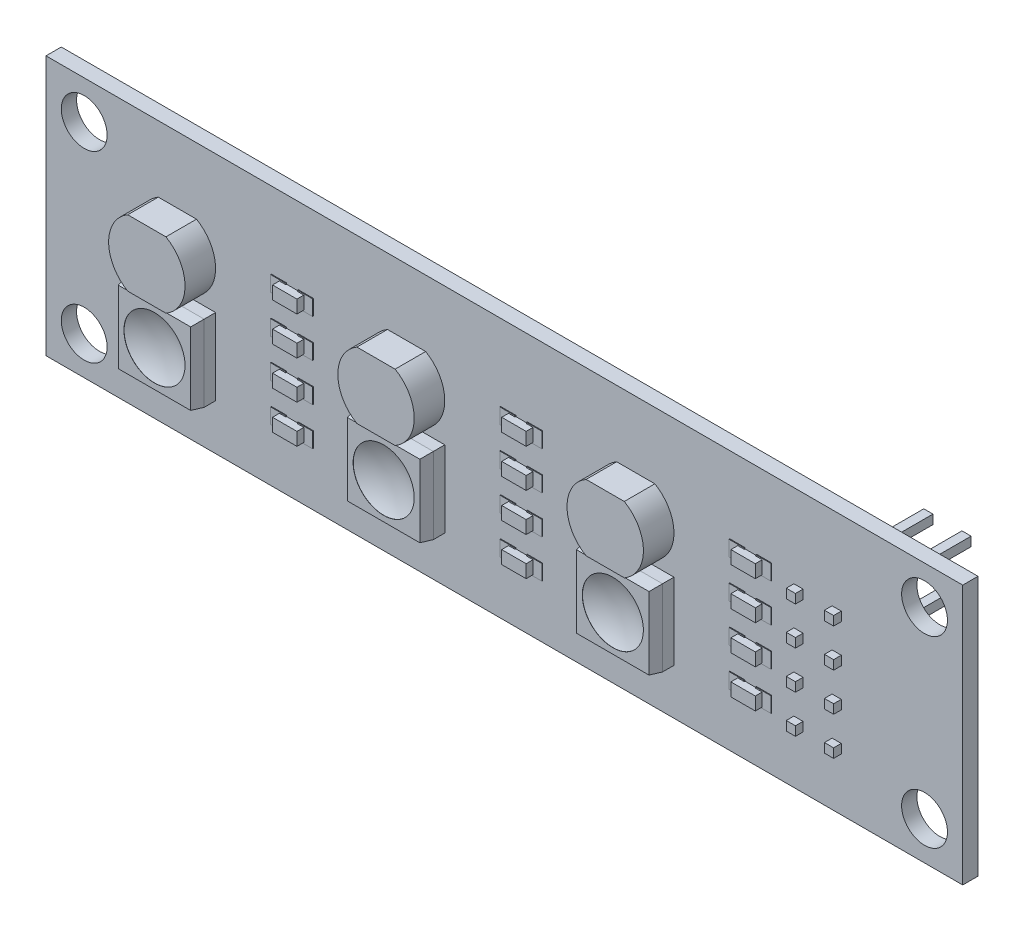
from build123d import *

# Parameters (mm, degrees)
CROQUIS1_W                  = 60
CROQUIS1_H                  = 17
CROQUIS1_R                  = 1.5
SALIENTE_EXTRUIR1_DEPTH     = 1
CROQUIS2_W                  = 5
CROQUIS2_H                  = 5
SALIENTE_EXTRUIR2_DEPTH     = 0.75
CROQUIS3_W                  = 5
CROQUIS3_H                  = 5
SALIENTE_EXTRUIR3_DEPTH     = 0.75
SALIENTE_EXTRUIR3_TAPER     = 10
CROQUIS4_R                  = 2
CORTAR_EXTRUIR1_DEPTH       = 0.01
C_PULA1_FACE_RADIUS         = 2
C_PULA1_HEIGHT              = 0.5
MATRIZL6_COUNT              = 3
MATRIZL6_PITCH              = 15
MATRIZL6_COPY_1_FACE_RADIUS = 2
MATRIZL6_COPY_1_HEIGHT      = 0.5
MATRIZL6_COPY_2_FACE_RADIUS = 2
MATRIZL6_COPY_2_HEIGHT      = 0.5
SALIENTE_EXTRUIR4_DEPTH     = 2
MATRIZL7_COUNT              = 3
MATRIZL7_PITCH              = 15
CROQUIS6_W                  = 1
CROQUIS6_H                  = 1
SALIENTE_EXTRUIR5_DEPTH     = 0.05
CROQUIS7_W                  = 1.6
CROQUIS7_H                  = 0.85
SALIENTE_EXTRUIR6_DEPTH     = 0.5
MATRIZL8_COUNT              = 3
MATRIZL8_PITCH              = 15
MATRIZL8_COUNT_DIR2         = 4
MATRIZL8_PITCH_DIR2         = 2.5
SALIENTE_EXTRUIR7_DEPTH     = 2.5
CROQUIS9_W                  = 0.6
CROQUIS9_H                  = 0.6
SALIENTE_EXTRUIR8_DEPTH     = 6
MATRIZL9_COUNT              = 4
MATRIZL9_PITCH              = 2.5
CROQUIS10_W                 = 0.6
CROQUIS10_H                 = 0.6
SALIENTE_EXTRUIR9_DEPTH     = 9
MATRIZL10_COUNT             = 4
MATRIZL10_PITCH             = 2.5
MATRIZL10_COUNT_DIR2        = 2
MATRIZL10_PITCH_DIR2        = 2.5


with BuildPart() as part:
    # Croquis1 → Saliente-Extruir1 (new body)
    with BuildSketch(Plane.XY):
        Rectangle(CROQUIS1_W, CROQUIS1_H)
        with Locations((-27.5, 6)):
            Circle(CROQUIS1_R, mode=Mode.SUBTRACT)
        with Locations(Location((-27.5, -6, 0), (0, 0, 180))):
            Circle(CROQUIS1_R, mode=Mode.SUBTRACT)
        with Locations((27.5, -6)):
            Circle(CROQUIS1_R, mode=Mode.SUBTRACT)
        with Locations(Location((27.5, 6, 0), (0, 0, 180))):
            Circle(CROQUIS1_R, mode=Mode.SUBTRACT)
    extrude(amount=SALIENTE_EXTRUIR1_DEPTH)

    # Croquis2 → Saliente-Extruir2 (add)
    with BuildSketch(Plane.XY.offset(1)):
        with Locations((-21.4, -3)):
            Rectangle(CROQUIS2_W, CROQUIS2_H)
    saliente_extruir2 = extrude(amount=SALIENTE_EXTRUIR2_DEPTH)

    # Croquis3 → Saliente-Extruir3 (add)
    with BuildSketch(Plane.XY.offset(1.75)):
        with Locations((-21.4, -3)):
            Rectangle(CROQUIS3_W, CROQUIS3_H)
    saliente_extruir3 = extrude(amount=SALIENTE_EXTRUIR3_DEPTH, taper=SALIENTE_EXTRUIR3_TAPER)

    # Croquis4 → Cortar-Extruir1 (cut)
    with BuildSketch(Plane.XY.offset(2.5)):
        with Locations((-21.4, -3)):
            Circle(CROQUIS4_R)
    cortar_extruir1 = extrude(amount=-CORTAR_EXTRUIR1_DEPTH, mode=Mode.SUBTRACT)

    # Cúpula1: a dome of height H over a round flat face of radius A is a cap of a sphere of radius (A * A + H * H) / (2 * H)
    c_pula1_r = (C_PULA1_FACE_RADIUS * C_PULA1_FACE_RADIUS + C_PULA1_HEIGHT * C_PULA1_HEIGHT) / (2 * C_PULA1_HEIGHT)
    c_pula1_base = Plane((-21.4, -3, 2.49), z_dir=(0, 0, -1))
    with Locations(c_pula1_base.offset(C_PULA1_HEIGHT - c_pula1_r)):
        c_pula1_ball = Sphere(c_pula1_r, mode=Mode.PRIVATE)
    add(split(c_pula1_ball, bisect_by=c_pula1_base, keep=Keep.TOP, mode=Mode.PRIVATE), mode=Mode.SUBTRACT)

    # MatrizL6: Saliente-Extruir2, Saliente-Extruir3, Cortar-Extruir1 ×3
    with Locations(*[(i * MATRIZL6_PITCH, 0, 0) for i in range(1, MATRIZL6_COUNT)]):
        add(saliente_extruir2)
        add(saliente_extruir3)
        add(cortar_extruir1, mode=Mode.SUBTRACT)

    # MatrizL6 copy 1: a dome of height H over a round flat face of radius A is a cap of a sphere of radius (A * A + H * H) / (2 * H)
    matrizl6_copy_1_r = (MATRIZL6_COPY_1_FACE_RADIUS * MATRIZL6_COPY_1_FACE_RADIUS + MATRIZL6_COPY_1_HEIGHT * MATRIZL6_COPY_1_HEIGHT) / (2 * MATRIZL6_COPY_1_HEIGHT)
    matrizl6_copy_1_base = Plane((-6.4, -3, 2.49), z_dir=(0, 0, -1))
    with Locations(matrizl6_copy_1_base.offset(MATRIZL6_COPY_1_HEIGHT - matrizl6_copy_1_r)):
        matrizl6_copy_1_ball = Sphere(matrizl6_copy_1_r, mode=Mode.PRIVATE)
    add(split(matrizl6_copy_1_ball, bisect_by=matrizl6_copy_1_base, keep=Keep.TOP, mode=Mode.PRIVATE), mode=Mode.SUBTRACT)

    # MatrizL6 copy 2: a dome of height H over a round flat face of radius A is a cap of a sphere of radius (A * A + H * H) / (2 * H)
    matrizl6_copy_2_r = (MATRIZL6_COPY_2_FACE_RADIUS * MATRIZL6_COPY_2_FACE_RADIUS + MATRIZL6_COPY_2_HEIGHT * MATRIZL6_COPY_2_HEIGHT) / (2 * MATRIZL6_COPY_2_HEIGHT)
    matrizl6_copy_2_base = Plane((8.6, -3, 2.49), z_dir=(0, 0, -1))
    with Locations(matrizl6_copy_2_base.offset(MATRIZL6_COPY_2_HEIGHT - matrizl6_copy_2_r)):
        matrizl6_copy_2_ball = Sphere(matrizl6_copy_2_r, mode=Mode.PRIVATE)
    add(split(matrizl6_copy_2_ball, bisect_by=matrizl6_copy_2_base, keep=Keep.TOP, mode=Mode.PRIVATE), mode=Mode.SUBTRACT)

    # Croquis5 → Saliente-Extruir4 (add)
    with BuildSketch(Plane.XY.offset(1)):
        with BuildLine():
            Line((-22.65, 4.165063509), (-20.15, 4.165063509))
            ThreePointArc((-20.15, 4.165063509), (-18.9, 2), (-20.15, -0.165063509))
            Line((-20.15, -0.165063509), (-22.65, -0.165063509))
            ThreePointArc((-22.65, -0.165063509), (-23.9, 2), (-22.65, 4.165063509))
        make_face()
    saliente_extruir4 = extrude(amount=SALIENTE_EXTRUIR4_DEPTH)

    # MatrizL7: Saliente-Extruir4 ×3
    with Locations(*[(i * MATRIZL7_PITCH, 0, 0) for i in range(1, MATRIZL7_COUNT)]):
        add(saliente_extruir4)

    # Croquis6 → Saliente-Extruir5 (add)
    with BuildSketch(Plane.XY.offset(1)):
        with Locations((-14.75, -4.5)):
            Rectangle(CROQUIS6_W, CROQUIS6_H)
        with Locations((-13, -4.5)):
            Rectangle(CROQUIS6_W, CROQUIS6_H)
        with Locations((0.25, -4.5)):
            Rectangle(CROQUIS6_W, CROQUIS6_H)
        with Locations((2, -4.5)):
            Rectangle(CROQUIS6_W, CROQUIS6_H)
        with Locations((15.25, -4.5)):
            Rectangle(CROQUIS6_W, CROQUIS6_H)
        with Locations((17, -4.5)):
            Rectangle(CROQUIS6_W, CROQUIS6_H)
        with Locations((0.25, -2)):
            Rectangle(CROQUIS6_W, CROQUIS6_H)
        with Locations((2, -2)):
            Rectangle(CROQUIS6_W, CROQUIS6_H)
        with Locations((15.25, -2)):
            Rectangle(CROQUIS6_W, CROQUIS6_H)
        with Locations((17, -2)):
            Rectangle(CROQUIS6_W, CROQUIS6_H)
        with Locations((0.25, 0.5)):
            Rectangle(CROQUIS6_W, CROQUIS6_H)
        with Locations((2, 0.5)):
            Rectangle(CROQUIS6_W, CROQUIS6_H)
        with Locations((15.25, 0.5)):
            Rectangle(CROQUIS6_W, CROQUIS6_H)
        with Locations((17, 0.5)):
            Rectangle(CROQUIS6_W, CROQUIS6_H)
        with Locations((0.25, 3)):
            Rectangle(CROQUIS6_W, CROQUIS6_H)
        with Locations((2, 3)):
            Rectangle(CROQUIS6_W, CROQUIS6_H)
        with Locations((15.25, 3)):
            Rectangle(CROQUIS6_W, CROQUIS6_H)
        with Locations((17, 3)):
            Rectangle(CROQUIS6_W, CROQUIS6_H)
        with Locations((-14.75, -2)):
            Rectangle(CROQUIS6_W, CROQUIS6_H)
        with Locations((-13, -2)):
            Rectangle(CROQUIS6_W, CROQUIS6_H)
        with Locations((-14.75, 0.5)):
            Rectangle(CROQUIS6_W, CROQUIS6_H)
        with Locations((-13, 0.5)):
            Rectangle(CROQUIS6_W, CROQUIS6_H)
        with Locations((-14.75, 3)):
            Rectangle(CROQUIS6_W, CROQUIS6_H)
        with Locations((-13, 3)):
            Rectangle(CROQUIS6_W, CROQUIS6_H)
    extrude(amount=SALIENTE_EXTRUIR5_DEPTH)

    # Croquis7 → Saliente-Extruir6 (add)
    with BuildSketch(Plane.XY.offset(1)):
        with Locations((-13.875, -4.5)):
            Rectangle(CROQUIS7_W, CROQUIS7_H)
    saliente_extruir6 = extrude(amount=SALIENTE_EXTRUIR6_DEPTH)

    # MatrizL8: Saliente-Extruir6 3 × 4
    with Locations(*[(i * MATRIZL8_PITCH, j * MATRIZL8_PITCH_DIR2, 0) for i in range(MATRIZL8_COUNT) for j in range(MATRIZL8_COUNT_DIR2) if (i, j) != (0, 0)]):
        add(saliente_extruir6)

    # Croquis8 → Saliente-Extruir7 (add)
    with BuildSketch(Plane.XY.offset(1)):
        with BuildLine():
            Line((18.5, -6), (22.5, -6))
            ThreePointArc((22.5, -6), (22.853553391, -5.853553391), (23, -5.5))
            Line((23, -5.5), (23, -4))
            ThreePointArc((23, -4), (22.853553391, -3.646446609), (22.5, -3.5))
            Line((22.5, -3.5), (18.5, -3.5))
            ThreePointArc((18.5, -3.5), (18.146446609, -3.646446609), (18, -4))
            Line((18, -4), (18, -5.5))
            ThreePointArc((18, -5.5), (18.146446609, -5.853553391), (18.5, -6))
        make_face()
    saliente_extruir7 = extrude(amount=-SALIENTE_EXTRUIR7_DEPTH)

    # Croquis9 → Saliente-Extruir8 (add)
    with BuildSketch(Plane(origin=(0, 0, -1.5), x_dir=(-1, 0, 0), z_dir=(0, 0, -1))):
        with Locations((-21.75, -4.75)):
            Rectangle(CROQUIS9_W, CROQUIS9_H)
        with Locations((-19.25, -4.75)):
            Rectangle(CROQUIS9_W, CROQUIS9_H)
    saliente_extruir8 = extrude(amount=SALIENTE_EXTRUIR8_DEPTH)

    # MatrizL9: Saliente-Extruir7, Saliente-Extruir8 ×4
    with Locations(*[(0, i * MATRIZL9_PITCH, 0) for i in range(1, MATRIZL9_COUNT)]):
        add(saliente_extruir7)
        add(saliente_extruir8)

    # Croquis10 → Saliente-Extruir9 (add)
    with BuildSketch(Plane(origin=(0, 0, -7.5), x_dir=(-1, 0, 0), z_dir=(0, 0, -1))):
        with Locations((-21.75, -4.75)):
            Rectangle(CROQUIS10_W, CROQUIS10_H)
    saliente_extruir9 = extrude(amount=-SALIENTE_EXTRUIR9_DEPTH)

    # MatrizL10: Saliente-Extruir9 4 × 2
    with Locations(*[(-j * MATRIZL10_PITCH_DIR2, i * MATRIZL10_PITCH, 0) for i in range(MATRIZL10_COUNT) for j in range(MATRIZL10_COUNT_DIR2) if (i, j) != (0, 0)]):
        add(saliente_extruir9)


solid = part.part
